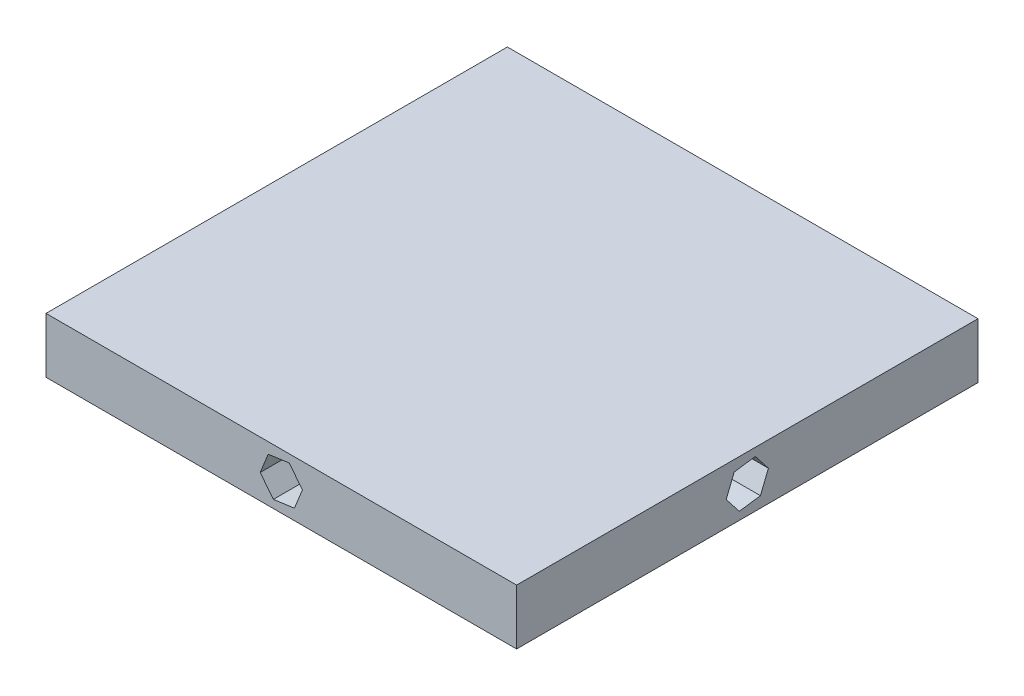
from build123d import *

# Parameters (mm, degrees)
ESBO_O2_W                = 51
ESBO_O2_H                = 50
RESSALTO_EXTRUS_O2_DEPTH = 6
CORTE_EXTRUS_O1_START    = -1
CORTE_EXTRUS_O1_DEPTH    = 15
PADR_OCIRCULAR1_COUNT    = 4


with BuildPart() as part:
    # Esboço2 → Ressalto-extrusão2 (new body)
    with BuildSketch(Plane(origin=(0, 0, 0), x_dir=(1, 0, 0), z_dir=(0, 1, 0))):
        Rectangle(ESBO_O2_W, ESBO_O2_H)
    extrude(amount=RESSALTO_EXTRUS_O2_DEPTH)

    # Esboço3 → Corte-extrusão1 (cut)
    with BuildSketch(Plane.ZY.offset(-25.5).offset(CORTE_EXTRUS_O1_START)):
        Polygon((-1.421809274, 1.180167117), (0.86511687, 0.858760608), (2.286926144, 2.678593491), (1.421809274, 4.819832883), (-0.86511687, 5.141239392), (-2.286926144, 3.321406509), align=None)
    corte_extrus_o1 = extrude(amount=CORTE_EXTRUS_O1_DEPTH, mode=Mode.SUBTRACT)

    # PadrãoCircular1: Corte-extrusão1 ×4 about axis
    padr_ocircular1_axis = Axis((0, 0, 0), (0, 1, 0))
    for i in range(1, PADR_OCIRCULAR1_COUNT):
        add(corte_extrus_o1.rotate(padr_ocircular1_axis, i * 360 / PADR_OCIRCULAR1_COUNT), mode=Mode.SUBTRACT)


solid = part.part
